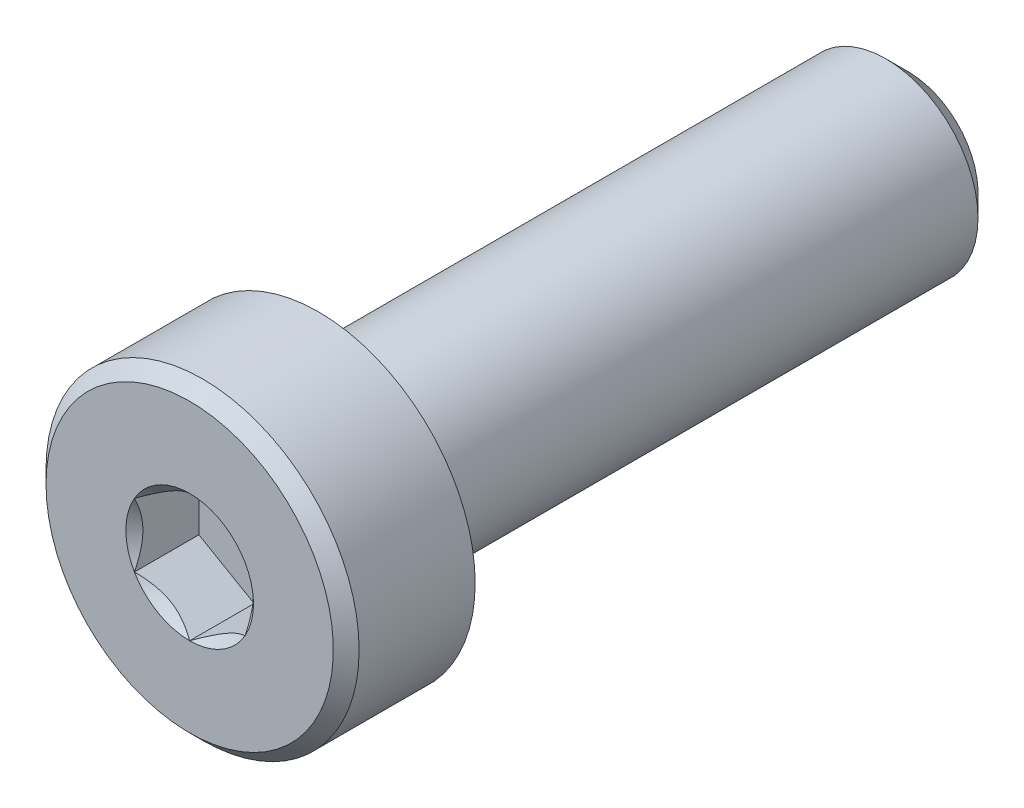
from build123d import *

# Parameters (mm, degrees)
CUT_EXTRUDE1_DEPTH = 1.75


with BuildPart() as part:
    # Sketch2 → Revolve1 (revolve)
    with BuildSketch(Plane(origin=(0, 0, 0), x_dir=(0, 0, -1), z_dir=(1, 0, 0)), mode=Mode.PRIVATE) as revolve1_sk:
        Polygon((-9.75, 0), (-9.75, 3.9), (-9.4, 4.25), (-6.25, 4.25), (-6.25, 2.5), (9.15, 2.5), (9.75, 1.9), (9.75, 0), align=None)
    revolve(revolve1_sk.sketch.rotate(Axis((0, 0, -9.75), (0, 0, 1)), 90), axis=Axis((0, 0, -9.75), (0, 0, 1)))

    # Sketch4 → Cut-Extrude1 (cut)
    with BuildSketch(Plane.XY.offset(9.75)):
        Polygon((1.5, -0.866025404), (1.5, 0.866025404), (0, 1.732050808), (-1.5, 0.866025404), (-1.5, -0.866025404), (0, -1.732050808), align=None)
    extrude(amount=-CUT_EXTRUDE1_DEPTH, mode=Mode.SUBTRACT)

    # Cut-Extrude2 cone 1 section (through the dimple's axis) → Cut-Extrude2 (revolve, cut)
    with BuildSketch(Plane(origin=(0, 0, 9.75), x_dir=(0, -1, 0), z_dir=(1, 0, 0))):
        Polygon((0, 0), (1.732050808, 0), (0, 1.732050808), align=None)
    revolve(axis=Axis((0, 0, 9.75), (0, 0, -1)), mode=Mode.SUBTRACT)


solid = part.part
